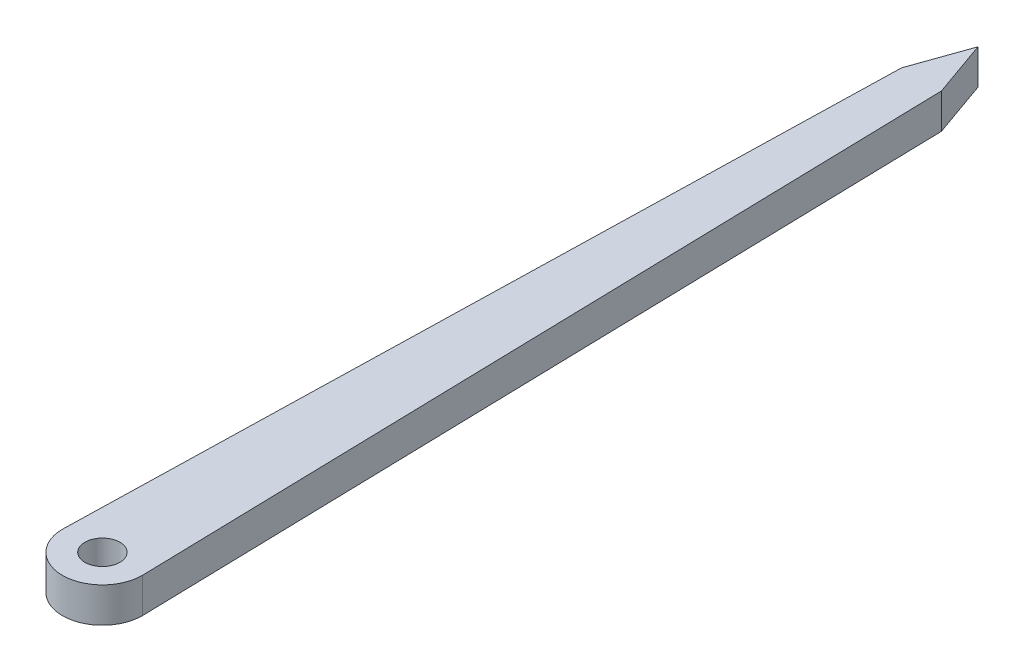
from build123d import *

# Parameters (mm, degrees)
SKICA1_R                = 1.75
P_IDAT_VYSUNUT_M1_DEPTH = 3.5


with BuildPart() as part:
    # Skica1 → Přidat vysunutím1 (new body)
    # profile 1 of 2: a face of its own
    with BuildSketch(Plane(origin=(0, 0, 0), x_dir=(1, 0, 0), z_dir=(0, 1, 0))):
        with BuildLine():
            Line((-2, 82), (-3.995243757, 0.195005945))
            ThreePointArc((-3.995243757, 0.195005945), (0, 4), (3.995243757, 0.195005945))
            Line((3.995243757, 0.195005945), (2, 82))
            Line((2, 82), (0, 87.656854249))
            Line((0, 87.656854249), (-2, 82))
        make_face()
    # profile 2 of 2: a face of its own
    with BuildSketch(Plane(origin=(0, 0, 0), x_dir=(1, 0, 0), z_dir=(0, 1, 0))):
        with BuildLine():
            Line((-3.995243757, 0.195005945), (-4, 0))
            ThreePointArc((-4, 0), (0, -4), (4, 0))
            Line((4, 0), (3.995243757, 0.195005945))
            ThreePointArc((3.995243757, 0.195005945), (0, 4), (-3.995243757, 0.195005945))
        make_face()
        with Locations(Location((0, 0, 0), (0, 0, 270))):
            Circle(SKICA1_R, mode=Mode.SUBTRACT)
    extrude(amount=P_IDAT_VYSUNUT_M1_DEPTH)


solid = part.part
